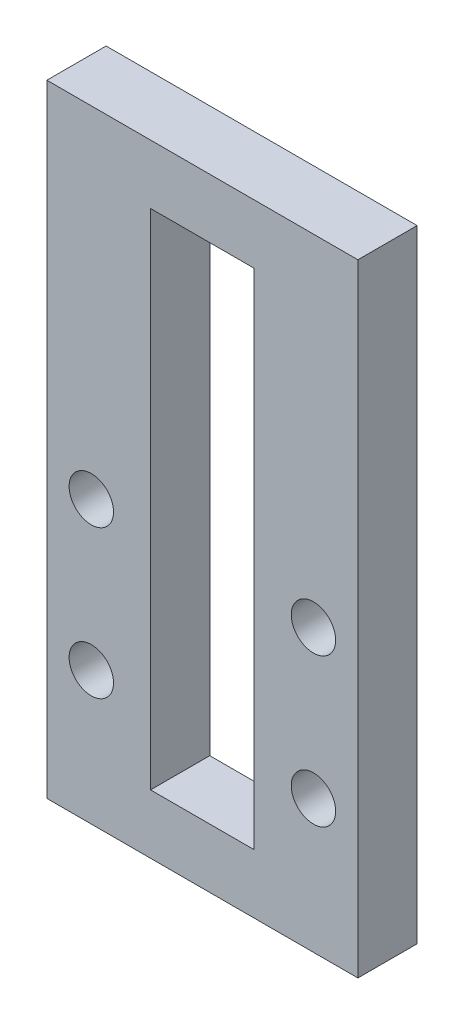
from build123d import *

# Parameters (mm, degrees)
SKETCH_1_R          = 1.5
EXTRUDE_1_DEPTH     = 4
FILLET_1_R          = 2
SKETCH_3_W          = 25.138692766
SKETCH_3_H          = 29.703861026
CUT_EXTRUDE_1_DEPTH = 38.446628687
SKETCH_4_W          = 21
SKETCH_4_H          = 14
EXTRUDE_2_DEPTH     = 4
SKETCH_5_W          = 7
SKETCH_5_H          = 34
CUT_EXTRUDE_2_DEPTH = 31.170349683


with BuildPart() as part:
    # 草图1 → 凸台-拉伸1 (new body)
    with BuildSketch(Plane.XY):
        Polygon((-10.5, 14), (10.5, 14), (10.5, 4), (34.5, 4), (34.5, -4), (10.5, -4), (10.5, -14), (-10.5, -14), align=None)
        with Locations((-7.5, 5)):
            Circle(SKETCH_1_R, mode=Mode.SUBTRACT)
        with Locations((7.5, 5)):
            Circle(SKETCH_1_R, mode=Mode.SUBTRACT)
        with Locations((-7.5, -5)):
            Circle(SKETCH_1_R, mode=Mode.SUBTRACT)
        with Locations((7.5, -5)):
            Circle(SKETCH_1_R, mode=Mode.SUBTRACT)
        with Locations((16.5, 0)):
            Circle(SKETCH_1_R, mode=Mode.SUBTRACT)
        with Locations((31.5, 0)):
            Circle(SKETCH_1_R, mode=Mode.SUBTRACT)
    extrude(amount=EXTRUDE_1_DEPTH)

    # 圆角1
    fillet_1_edges = [part.edges().sort_by_distance(p)[0] for p in [
        (10.5, 4, 2),
        (10.5, -4, 2),
    ]]
    fillet(fillet_1_edges, radius=FILLET_1_R)

    # 草图3 → 切除-拉伸1 (cut, through all)
    with BuildSketch(Plane.XY.offset(4)):
        with Locations((23.069346383, -0.851930513)):
            Rectangle(SKETCH_3_W, SKETCH_3_H)
    extrude(amount=-CUT_EXTRUDE_1_DEPTH, mode=Mode.SUBTRACT)

    # 草图4 → 凸台-拉伸2 (add)
    with BuildSketch(Plane.XY.offset(4)):
        with Locations((0, 21)):
            Rectangle(SKETCH_4_W, SKETCH_4_H)
    extrude(amount=-EXTRUDE_2_DEPTH)

    # 草图5 → 切除-拉伸2 (cut, through all)
    with BuildSketch(Plane.XY.offset(4)):
        with Locations((0, 7)):
            Rectangle(SKETCH_5_W, SKETCH_5_H)
    extrude(amount=-CUT_EXTRUDE_2_DEPTH, mode=Mode.SUBTRACT)


solid = part.part
